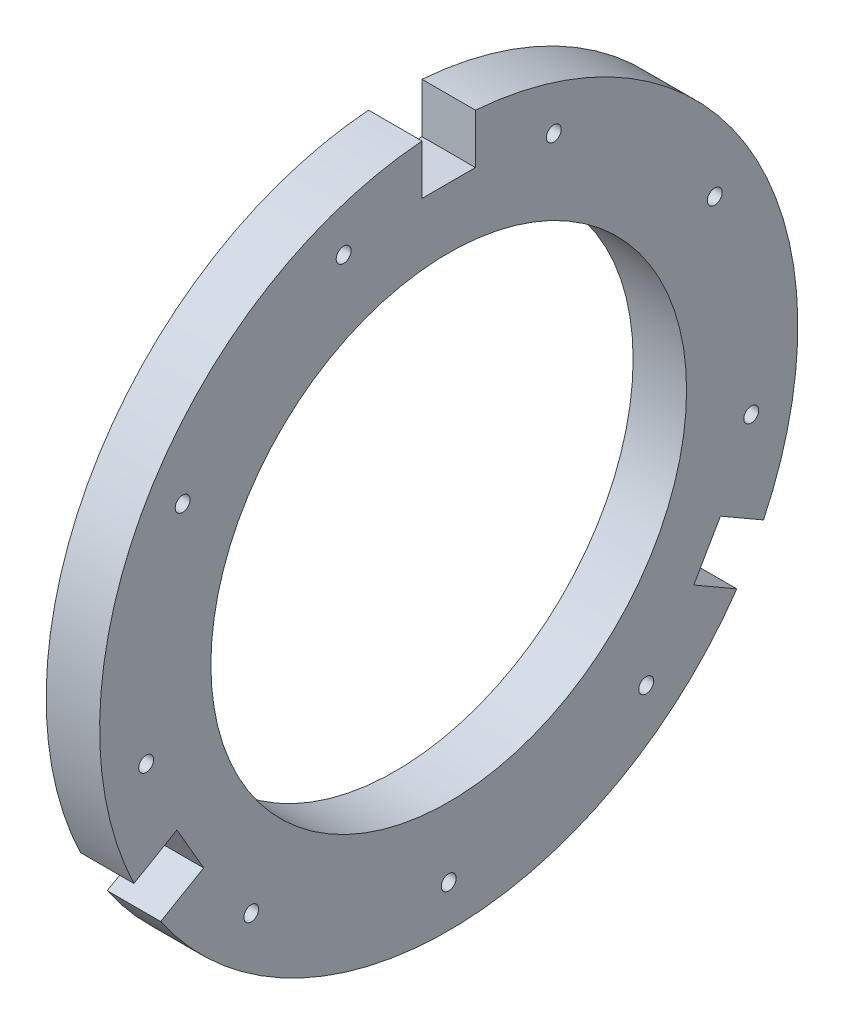
from build123d import *

# Parameters (mm, degrees)
ESQUISSE1_R             = 51.1
BOSS_EXTRU_1_DEPTH      = 11.482
CUT_EXTRUDE1_DEPTH      = 107.685689406
CUT_EXTRUDE1_DEPTH_BACK = 107.685689406
SKETCH1_R               = 1.6


with BuildPart() as part:
    # Esquisse1 → Boss.-Extru.1 (new body)
    with BuildSketch(Plane(origin=(0, 0, 0), x_dir=(0, 0, -1), z_dir=(1, 0, 0))):
        with BuildLine():
            Line((-5.741, 64.1), (-5.741, 74.77994998))
            ThreePointArc((-5.741, 74.77994998), (-64.951905284, 37.5), (-67.631836376, -32.418123147))
            Line((-67.631836376, -32.418123147), (-58.382728383, -27.078148157))
            Line((-58.382728383, -27.078148157), (-52.641728383, -37.021851843))
            Line((-52.641728383, -37.021851843), (-61.890836376, -42.361826833))
            ThreePointArc((-61.890836376, -42.361826833), (0, -75), (61.890836376, -42.361826833))
            Line((61.890836376, -42.361826833), (52.641728383, -37.021851843))
            Line((52.641728383, -37.021851843), (58.382728383, -27.078148157))
            Line((58.382728383, -27.078148157), (67.631836376, -32.418123147))
            ThreePointArc((67.631836376, -32.418123147), (64.951905284, 37.5), (5.741, 74.77994998))
            Line((5.741, 74.77994998), (5.741, 64.1))
            Line((5.741, 64.1), (-5.741, 64.1))
        make_face()
        Circle(ESQUISSE1_R, mode=Mode.SUBTRACT)
    extrude(amount=BOSS_EXTRU_1_DEPTH)

    # Sketch1 → Cut-Extrude1 (cut, two sides: drawn at the far end of the back side and taken through both)
    with BuildSketch(Plane(origin=(0, 0, 0), x_dir=(0, 0, -1), z_dir=(1, 0, 0)).offset(-CUT_EXTRUDE1_DEPTH_BACK)):
        with Locations((22.573329459, 62.019712972)):
            Circle(SKETCH1_R)
        with Locations((57.15767665, 33)):
            Circle(SKETCH1_R)
        with Locations((64.997311699, -11.460779726)):
            Circle(SKETCH1_R)
        with Locations((42.423982239, -50.558933246)):
            Circle(SKETCH1_R)
        with Locations((0, -66)):
            Circle(SKETCH1_R)
        with Locations((-42.423982239, -50.558933246)):
            Circle(SKETCH1_R)
        with Locations((-64.997311699, -11.460779726)):
            Circle(SKETCH1_R)
        with Locations((-57.15767665, 33)):
            Circle(SKETCH1_R)
        with Locations((-22.573329459, 62.019712972)):
            Circle(SKETCH1_R)
    extrude(amount=CUT_EXTRUDE1_DEPTH + CUT_EXTRUDE1_DEPTH_BACK, mode=Mode.SUBTRACT)


solid = part.part
